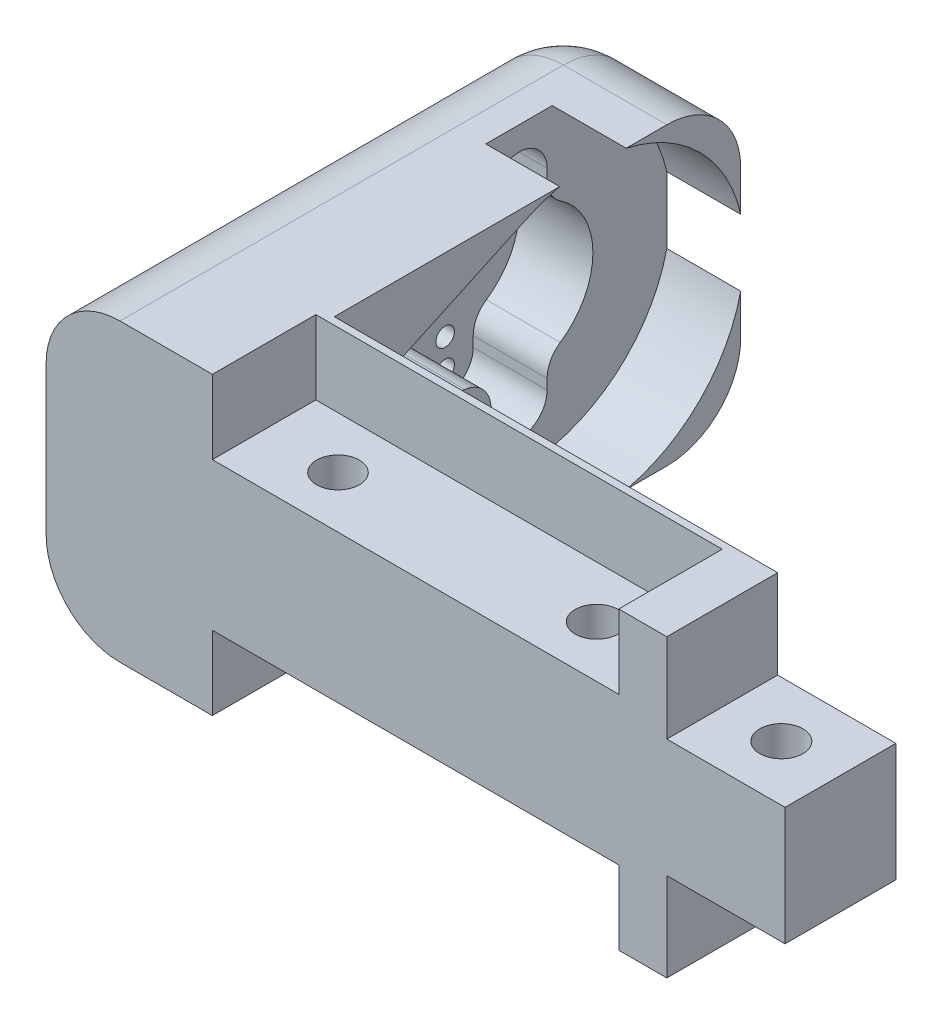
from build123d import *

# Parameters (mm, degrees)
EXTRUDE_1_DEPTH      = 20
FILLET_1_R           = 5
SKETCH_2_R           = 8
CUT_EXTRUDE_1_DEPTH  = 5
SKETCH_3_R           = 6
CUT_EXTRUDE_2_DEPTH  = 1
CUT_EXTRUDE_3_DEPTH  = 5
CUT_EXTRUDE_4_DEPTH  = 5
SKETCH_6_R           = 0.625
CUT_EXTRUDE_5_DEPTH  = 4
SKETCH_7_W           = 27.5
SKETCH_7_H           = 5
CUT_EXTRUDE_6_DEPTH  = 7
SKETCH_8_R           = 1.45
CUT_EXTRUDE_7_DEPTH  = 12
CUT_EXTRUDE_8_DEPTH  = 6
CUT_EXTRUDE_START    = -20
CUT_EXTRUDE_9_DEPTH  = 6
SKETCH_13_W          = 12
SKETCH_13_H          = 27.5
CUT_EXTRUDE_10_DEPTH = 11
SKETCH_14_R          = 1.46
CUT_EXTRUDE_11_DEPTH = 11


with BuildPart() as part:
    # Эскиз1 → Бобышка-Вытянуть1 (new body)
    with BuildSketch(Plane(origin=(0, 0, 0), x_dir=(1, 0, 0), z_dir=(0, 1, 0))):
        Polygon((-13, 27.5), (-13, 0), (13, 0), (13, 27.5), (25, 27.5), (25, -7.5), (-25, -7.5), (-25, 27.5), align=None)
    extrude(amount=EXTRUDE_1_DEPTH)

    # Скругление1
    fillet_1_edges = [part.edges().sort_by_distance(p)[0] for p in [
        (19, 0, -27.5),
        (25, 10, -27.5),
        (-25, 10, -27.5),
        (-19, 20, -27.5),
        (-25, 20, -10),
        (25, 20, -10),
        (19, 20, -27.5),
        (25, 0, -10),
        (-25, 0, -10),
        (-19, 0, -27.5),
    ]]
    fillet(fillet_1_edges, radius=FILLET_1_R)

    # Эскиз2 → Вырез-Вытянуть1 (cut)
    with BuildSketch(Plane.ZY.offset(-13)):
        with Locations((-17.5, 10)):
            Circle(SKETCH_2_R)
    extrude(amount=-CUT_EXTRUDE_1_DEPTH, mode=Mode.SUBTRACT)

    # Эскиз3 → Вырез-Вытянуть2 (cut)
    with BuildSketch(Plane.ZY.offset(-18)):
        with Locations((-17.5, 10)):
            Circle(SKETCH_3_R)
    extrude(amount=-CUT_EXTRUDE_2_DEPTH, mode=Mode.SUBTRACT)

    # Эскиз4 → Вырез-Вытянуть3 (cut)
    with BuildSketch(Plane(origin=(-13, 0, 0), x_dir=(0, 0, -1), z_dir=(1, 0, 0))):
        with BuildLine():
            Line((13.195, 19.30212207), (2.9, 14.537620522))
            ThreePointArc((2.9, 14.537620522), (0, 10), (2.9, 5.462379478))
            Line((2.9, 5.462379478), (13.195, 0.69787793))
            ThreePointArc((13.195, 0.69787793), (27.75, 10), (13.195, 19.30212207))
        make_face()
    extrude(amount=-CUT_EXTRUDE_3_DEPTH, mode=Mode.SUBTRACT)

    # Эскиз5 → Вырез-Вытянуть4 (cut)
    with BuildSketch(Plane(origin=(-18, 0, 0), x_dir=(0, 0, -1), z_dir=(1, 0, 0))):
        with BuildLine():
            Line((19.4, 15.812916652), (19.4, 16.49838717))
            ThreePointArc((19.4, 16.49838717), (17.499999842, 18.39838717), (15.6, 16.498386854))
            Line((15.6, 16.498386854), (15.6, 15.665366642))
            ThreePointArc((15.6, 15.665366642), (15.094249889, 14.335999398), (13.832782732, 13.678959785))
            Line((13.832782732, 13.678959785), (1.932299859, 12.284367885))
            ThreePointArc((1.932299859, 12.284367885), (-0.1, 10), (1.932299859, 7.715632115))
            Line((1.932299859, 7.715632115), (13.832782732, 6.321040215))
            ThreePointArc((13.832782732, 6.321040215), (15.094249889, 5.664000602), (15.6, 4.334633358))
            Line((15.6, 4.334633358), (15.6, 3.501613146))
            ThreePointArc((15.6, 3.501613146), (17.5, 1.601613146), (19.4, 3.501613146))
            Line((19.4, 3.501613146), (19.4, 4.187083665))
            ThreePointArc((19.4, 4.187083665), (19.635266181, 5.128207436), (20.285714286, 5.847916677))
            ThreePointArc((20.285714286, 5.847916677), (22.5, 10), (20.285714286, 14.152083323))
            ThreePointArc((20.285714286, 14.152083323), (19.635266107, 14.871792704), (19.4, 15.812916652))
        make_face()
    extrude(amount=-CUT_EXTRUDE_4_DEPTH, mode=Mode.SUBTRACT)

    # Эскиз6 → Вырез-Вытянуть5 (cut)
    with BuildSketch(Plane(origin=(-23, 0, 0), x_dir=(0, 0, -1), z_dir=(1, 0, 0))):
        with Locations((2.278018202, 10)):
            Circle(SKETCH_6_R)
        with Locations((6.311115384, 10)):
            Circle(SKETCH_6_R)
        with Locations((10.428235425, 10)):
            Circle(SKETCH_6_R)
        with Locations((17.5, 14.907931149)):
            Circle(SKETCH_6_R)
        with Locations((17.5, 16.848859168)):
            Circle(SKETCH_6_R)
        with Locations((17.5, 5.082068851)):
            Circle(SKETCH_6_R)
        with Locations((17.5, 3.141140832)):
            Circle(SKETCH_6_R)
    extrude(amount=-CUT_EXTRUDE_5_DEPTH, mode=Mode.SUBTRACT)

    # Эскиз7 → Вырез-Вытянуть6 (cut)
    with BuildSketch(Plane.XY.offset(7.5)):
        with Locations((0, 17.5)):
            Rectangle(SKETCH_7_W, SKETCH_7_H)
        with Locations((0, 2.5)):
            Rectangle(SKETCH_7_W, SKETCH_7_H)
    extrude(amount=-CUT_EXTRUDE_6_DEPTH, mode=Mode.SUBTRACT)

    # Эскиз8 → Вырез-Вытянуть7 (cut)
    with BuildSketch(Plane(origin=(0, 15, 0), x_dir=(1, 0, 0), z_dir=(0, 1, 0))):
        with Locations(Location((-8.75, -4, 0), (0, 0, 270))):
            Circle(SKETCH_8_R)
        with Locations(Location((8.75, -4, 0), (0, 0, 270))):
            Circle(SKETCH_8_R)
    extrude(amount=-CUT_EXTRUDE_7_DEPTH, mode=Mode.SUBTRACT)

    # Эскиз11 → Вырез-Вытянуть8 (cut)
    with BuildSketch(Plane(origin=(0, 20, 0), x_dir=(1, 0, 0), z_dir=(0, 1, 0))):
        Polygon((13, 27.5), (13, 0), (17, 0), (17, -7.5), (25, -7.5), (25, 27.5), align=None)
    extrude(amount=-CUT_EXTRUDE_8_DEPTH, mode=Mode.SUBTRACT)

    # Эскиз11<2> → Вырез-Вытянуть9 (cut)
    with BuildSketch(Plane(origin=(0, 20, 0), x_dir=(1, 0, 0), z_dir=(0, 1, 0)).offset(CUT_EXTRUDE_START)):
        Polygon((13, 27.5), (13, 0), (17, 0), (17, -7.5), (25, -7.5), (25, 27.5), align=None)
    extrude(amount=CUT_EXTRUDE_9_DEPTH, mode=Mode.SUBTRACT)

    # Эскиз13 → Вырез-Вытянуть10 (cut)
    with BuildSketch(Plane(origin=(0, 14, 0), x_dir=(1, 0, 0), z_dir=(0, 1, 0))):
        with Locations((19, 13.75)):
            Rectangle(SKETCH_13_W, SKETCH_13_H)
    extrude(amount=-CUT_EXTRUDE_10_DEPTH, mode=Mode.SUBTRACT)

    # Эскиз14 → Вырез-Вытянуть11 (cut)
    with BuildSketch(Plane(origin=(0, 14, 0), x_dir=(1, 0, 0), z_dir=(0, 1, 0))):
        with Locations(Location((21, -3.75, 0), (0, 0, 270))):
            Circle(SKETCH_14_R)
    extrude(amount=-CUT_EXTRUDE_11_DEPTH, mode=Mode.SUBTRACT)


solid = part.part
